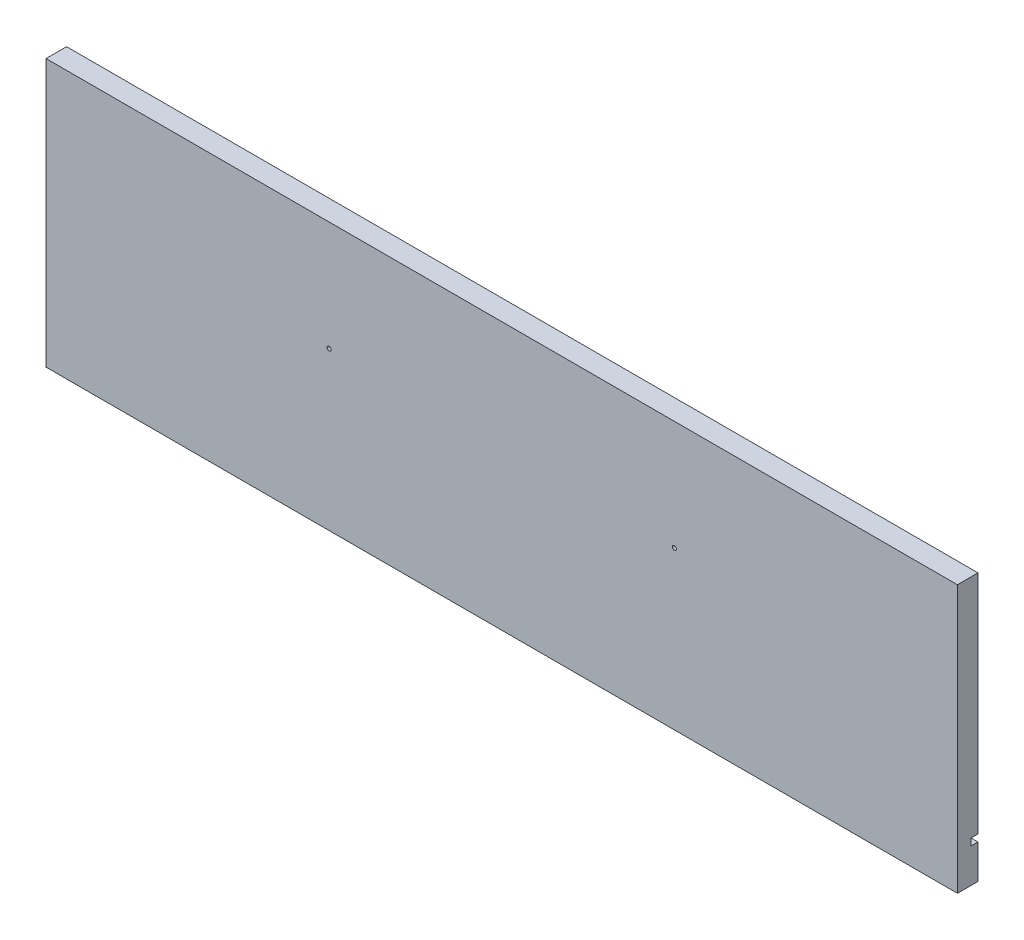
from build123d import *

# Parameters (mm, degrees)
SKETCH1_W                          = 665
SKETCH1_H                          = 195
BASE_EXTRUDE_DEPTH                 = 15
SKETCH2_W                          = 5
SKETCH2_H                          = 5
CUT_EXTRUDE1_DEPTH                 = 694.163039984
M3_0_3_000000_DIAMETER_HOLE1_D     = 3
M3_0_3_000000_DIAMETER_HOLE2_D     = 3
M3_0_3_000000_DIAMETER_HOLE2_DEPTH = 10
M3_0_3_000000_DIAMETER_HOLE2_TIP   = 0.901290929


with BuildPart() as part:
    # Sketch1 → Base-Extrude (new body)
    with BuildSketch(Plane.XY):
        with Locations((0, 97.5)):
            Rectangle(SKETCH1_W, SKETCH1_H)
    extrude(amount=-BASE_EXTRUDE_DEPTH)

    # Sketch2 → Cut-Extrude1 (cut, through all)
    with BuildSketch(Plane(origin=(332.5, 0, 0), x_dir=(0, 0, -1), z_dir=(1, 0, 0))):
        with Locations((12.5, 27.5)):
            Rectangle(SKETCH2_W, SKETCH2_H)
    extrude(amount=-CUT_EXTRUDE1_DEPTH, mode=Mode.SUBTRACT)

    # M3.0 (3.000000) Diameter Hole1 (through all)
    with Locations(Plane.XY):
        with Locations((-126, 115), (126, 115)):
            Hole(M3_0_3_000000_DIAMETER_HOLE1_D / 2)

    # M3.0 (3.000000) Diameter Hole2
    with Locations(Plane(origin=(0, 0, -15), x_dir=(-1, 0, 0), z_dir=(0, 0, -1))):
        with Locations((-325, 135), (-325, 45), (325, 135), (325, 45)):
            Hole(M3_0_3_000000_DIAMETER_HOLE2_D / 2, depth=M3_0_3_000000_DIAMETER_HOLE2_DEPTH)
            with Locations((0, 0, -(M3_0_3_000000_DIAMETER_HOLE2_DEPTH + M3_0_3_000000_DIAMETER_HOLE2_TIP / 2))):  # 118° drill point
                Cone(0, M3_0_3_000000_DIAMETER_HOLE2_D / 2, M3_0_3_000000_DIAMETER_HOLE2_TIP, mode=Mode.SUBTRACT)


solid = part.part
